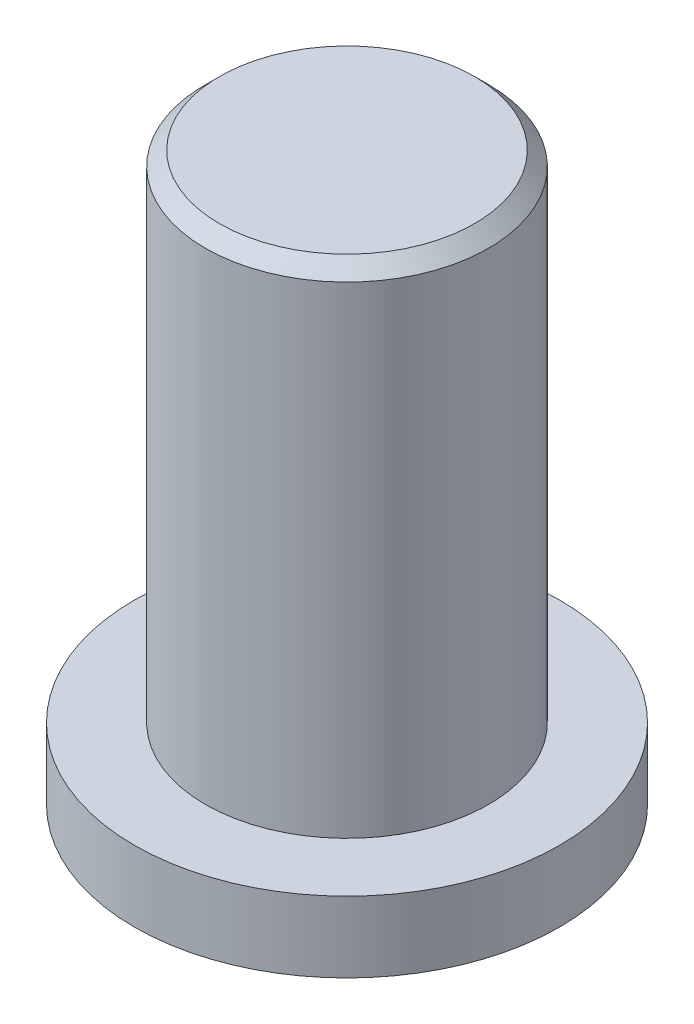
from build123d import *

# Parameters (mm, degrees)
CHAMFER1_SIZE = 1


with BuildPart() as part:
    # Sketch1 → Revolve1 (revolve)
    with BuildSketch(Plane.XY, mode=Mode.PRIVATE) as revolve1_sk:
        Polygon((0, 0), (0, 40), (10, 40), (10, 5), (15, 5), (15, 0), align=None)
    revolve(revolve1_sk.sketch.rotate(Axis((0, 28.71657754, 0), (0, -1, 0)), 90), axis=Axis((0, 28.71657754, 0), (0, -1, 0)))

    # Chamfer1
    chamfer1_edges = [part.edges().sort_by_distance(p)[0] for p in [
        (0, 40, -10),
    ]]
    chamfer(chamfer1_edges, length=CHAMFER1_SIZE)


solid = part.part
